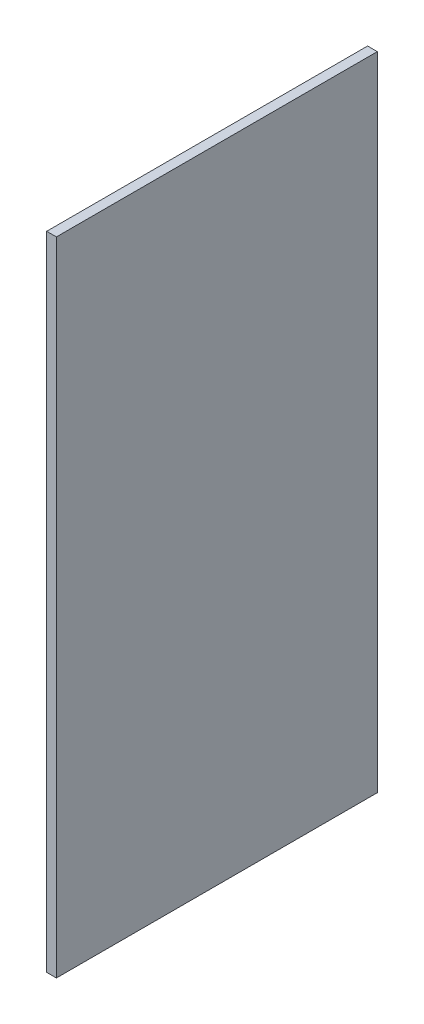
from build123d import *

# Parameters (mm, degrees)
SKETCH_1_W      = 165
SKETCH_1_H      = 330
EXTRUDE_1_DEPTH = 5


with BuildPart() as part:
    # 스케치1 → 보스-돌출1 (new body)
    with BuildSketch(Plane(origin=(0, 0, 0), x_dir=(0, 0, -1), z_dir=(1, 0, 0))):
        with Locations((82.5, 165)):
            Rectangle(SKETCH_1_W, SKETCH_1_H)
    extrude(amount=EXTRUDE_1_DEPTH)


solid = part.part
